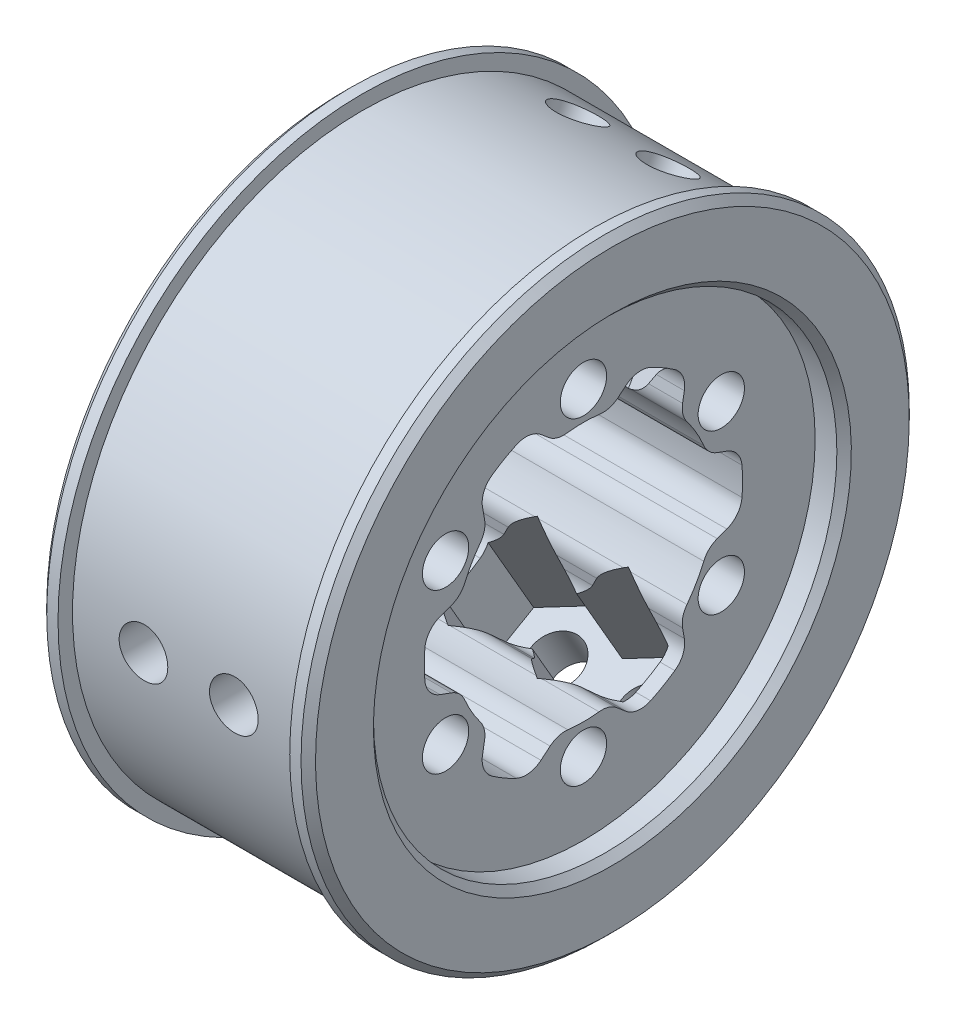
from build123d import *

# Parameters (mm, degrees)
SKETCH2_R           = 2.54
CUT_EXTRUDE3_DEPTH  = 56.595909099
SKETCH3_R           = 25.4
CUT_EXTRUDE4_DEPTH  = 3.175
CUT_EXTRUDE5_START  = -3.048
SKETCH4_R           = 25.4
CUT_EXTRUDE5_DEPTH  = 3.048
CHAMFER1_SIZE       = 0.79375
CUT_EXTRUDE6_START  = -5.08
CUT_EXTRUDE6_DEPTH  = 14.605
SKETCH10_R          = 2.667
CUT_EXTRUDE9_DEPTH  = 71.411931101
CIRPATTERN2_COUNT   = 3
SKETCH11_R          = 1.0922
CUT_EXTRUDE10_DEPTH = 67.761937332


with BuildPart() as part:
    # Sketch1 → Revolve1 (revolve)
    with BuildSketch(Plane.XY):
        Polygon((0, 0), (0, 31.75), (12.7, 31.75), (12.7, 33.3375), (14.732, 33.3375), (14.732, 0), align=None)
    revolve1 = revolve(axis=Axis((14.732, 0, 0), (-1, 0, 0)))

    # Mirror3: Revolve1 across plane
    add(revolve1.mirror(Plane.ZY))

    # Sketch2 → Cut-Extrude3 (cut, through all)
    with BuildSketch(Plane(origin=(14.732, 0, 0), x_dir=(0, 0, -1), z_dir=(1, 0, 0))):
        with Locations(Location((0, 17.4498, 0), (0, 0, 90))):
            Circle(SKETCH2_R)
        with Locations(Location((15.111970091, 8.7249, 0), (0, 0, 90))):
            Circle(SKETCH2_R)
        with Locations(Location((15.111970091, -8.7249, 0), (0, 0, 90))):
            Circle(SKETCH2_R)
        with Locations(Location((0, -17.4498, 0), (0, 0, 90))):
            Circle(SKETCH2_R)
        with Locations(Location((-15.111970091, -8.7249, 0), (0, 0, 90))):
            Circle(SKETCH2_R)
        with Locations(Location((-15.111970091, 8.7249, 0), (0, 0, 90))):
            Circle(SKETCH2_R)
        with BuildLine():
            Line((14.665568358, 4.08236111), (15.720738661, 3.698310528))
            ThreePointArc((15.720738661, 3.698310528), (16.866499311, 2.858560348), (17.382162096, 1.534913975))
            ThreePointArc((17.382162096, 1.534913975), (17.4498, 0), (17.382162096, -1.534913975))
            ThreePointArc((17.382162096, -1.534913975), (16.866499311, -2.858560348), (15.720738661, -3.698310528))
            Line((15.720738661, -3.698310528), (14.665568358, -4.08236111))
            ThreePointArc((14.665568358, -4.08236111), (13.779603056, -4.632705397), (13.189499594, -5.492700312))
            ThreePointArc((13.189499594, -5.492700312), (12.373337957, -7.14375), (11.351567802, -8.676091556))
            ThreePointArc((11.351567802, -8.676091556), (10.90184209, -9.617133602), (10.868212608, -10.659574204))
            Line((10.868212608, -10.659574204), (11.063200199, -11.765403783))
            ThreePointArc((11.063200199, -11.765403783), (10.908835536, -13.177536702), (10.020355543, -14.28593696))
            ThreePointArc((10.020355543, -14.28593696), (8.7249, -15.111970091), (7.361806553, -15.820850935))
            ThreePointArc((7.361806553, -15.820850935), (5.957663775, -16.03609705), (4.657538462, -15.46371431))
            Line((4.657538462, -15.46371431), (3.648569587, -14.617088899))
            ThreePointArc((3.648569587, -14.617088899), (2.738575306, -14.127821336), (1.709006412, -14.041448709))
            ThreePointArc((1.709006412, -14.041448709), (0, -14.145069274), (-1.709006412, -14.041448709))
            ThreePointArc((-1.709006412, -14.041448709), (-2.738575306, -14.127821336), (-3.648569587, -14.617088899))
            Line((-3.648569587, -14.617088899), (-4.657538462, -15.46371431))
            ThreePointArc((-4.657538462, -15.46371431), (-5.957663775, -16.03609705), (-7.361806553, -15.820850935))
            ThreePointArc((-7.361806553, -15.820850935), (-8.7249, -15.111970091), (-10.020355543, -14.28593696))
            ThreePointArc((-10.020355543, -14.28593696), (-10.908835536, -13.177536702), (-11.063200199, -11.765403783))
            Line((-11.063200199, -11.765403783), (-10.834485523, -10.468298399))
            ThreePointArc((-10.834485523, -10.468298399), (-10.865764524, -9.435586453), (-11.305748082, -8.500767323))
            ThreePointArc((-11.305748082, -8.500767323), (-12.249989329, -7.072534637), (-13.014754494, -5.540681386))
            ThreePointArc((-13.014754494, -5.540681386), (-13.60433983, -4.692234882), (-14.483055109, -4.1487905))
            Line((-14.483055109, -4.1487905), (-15.720738661, -3.698310528))
            ThreePointArc((-15.720738661, -3.698310528), (-16.866499311, -2.858560348), (-17.382162096, -1.534913975))
            ThreePointArc((-17.382162096, -1.534913975), (-17.4498, 0), (-17.382162096, 1.534913975))
            ThreePointArc((-17.382162096, 1.534913975), (-16.866499311, 2.858560348), (-15.720738661, 3.698310528))
            Line((-15.720738661, 3.698310528), (-14.483055109, 4.1487905))
            ThreePointArc((-14.483055109, 4.1487905), (-13.60433983, 4.692234882), (-13.014754494, 5.540681386))
            ThreePointArc((-13.014754494, 5.540681386), (-12.249989329, 7.072534637), (-11.305748082, 8.500767323))
            ThreePointArc((-11.305748082, 8.500767323), (-10.865764524, 9.435586453), (-10.834485523, 10.468298399))
            Line((-10.834485523, 10.468298399), (-11.063200199, 11.765403783))
            ThreePointArc((-11.063200199, 11.765403783), (-10.908835536, 13.177536702), (-10.020355543, 14.28593696))
            ThreePointArc((-10.020355543, 14.28593696), (-8.7249, 15.111970091), (-7.361806553, 15.820850935))
            ThreePointArc((-7.361806553, 15.820850935), (-5.957663775, 16.03609705), (-4.657538462, 15.46371431))
            Line((-4.657538462, 15.46371431), (-3.79735575, 14.741935314))
            ThreePointArc((-3.79735575, 14.741935314), (-2.877760966, 14.249838999), (-1.837931792, 14.168791867))
            ThreePointArc((-1.837931792, 14.168791867), (0, 14.2875), (1.837931792, 14.168791867))
            ThreePointArc((1.837931792, 14.168791867), (2.877760966, 14.249838999), (3.79735575, 14.741935314))
            Line((3.79735575, 14.741935314), (4.657538462, 15.46371431))
            ThreePointArc((4.657538462, 15.46371431), (5.957663775, 16.03609705), (7.361806553, 15.820850935))
            ThreePointArc((7.361806553, 15.820850935), (8.7249, 15.111970091), (10.020355543, 14.28593696))
            ThreePointArc((10.020355543, 14.28593696), (10.908835536, 13.177536702), (11.063200199, 11.765403783))
            Line((11.063200199, 11.765403783), (10.868212608, 10.659574204))
            ThreePointArc((10.868212608, 10.659574204), (10.90184209, 9.617133602), (11.351567802, 8.676091556))
            ThreePointArc((11.351567802, 8.676091556), (12.373337957, 7.14375), (13.189499594, 5.492700312))
            ThreePointArc((13.189499594, 5.492700312), (13.779603056, 4.632705397), (14.665568358, 4.08236111))
        make_face()
    extrude(amount=-CUT_EXTRUDE3_DEPTH, mode=Mode.SUBTRACT)

    # Sketch3 → Cut-Extrude4 (cut)
    with BuildSketch(Plane(origin=(14.732, 0, 0), x_dir=(0, 0, -1), z_dir=(1, 0, 0))):
        with Locations(Location((0, 0, 0), (0, 0, 90))):
            Circle(SKETCH3_R)
    extrude(amount=-CUT_EXTRUDE4_DEPTH, mode=Mode.SUBTRACT)

    # Sketch4 → Cut-Extrude5 (cut)
    with BuildSketch(Plane.ZY.offset(14.732).offset(CUT_EXTRUDE5_START)):
        with Locations(Location((0, 0, 0), (0, 0, 90))):
            Circle(SKETCH4_R)
    extrude(amount=CUT_EXTRUDE5_DEPTH, mode=Mode.SUBTRACT)

    # Chamfer1
    chamfer1_edges = [part.edges().sort_by_distance(p)[0] for p in [
        (-14.732, -33.3375, 0),
        (14.732, -25.4, 0),
        (-14.732, -25.4, 0),
        (14.732, -33.3375, 0),
    ]]
    chamfer(chamfer1_edges, length=CHAMFER1_SIZE)

    # Sketch7 → Cut-Extrude6 (cut)
    with BuildSketch(Plane.XY.offset(17.382162096).offset(CUT_EXTRUDE6_START)):
        Polygon((-4.92125, 5.60924654), (-9.779, 2.80462327), (-9.779, -2.80462327), (-4.92125, -5.60924654), (-0.0635, -2.80462327), (4.98475, -5.719231767), (9.93775, -2.859615883), (9.93775, 2.859615883), (4.98475, 5.719231767), (-0.0635, 2.80462327), align=None)
    cut_extrude6 = extrude(amount=CUT_EXTRUDE6_DEPTH, mode=Mode.SUBTRACT)

    # Sketch10 → Cut-Extrude9 (cut, through all)
    with BuildSketch(Plane(origin=(0, 0, 26.907162096), x_dir=(-1, 0, 0), z_dir=(0, 0, -1))):
        with Locations((-4.98475, 0)):
            Circle(SKETCH10_R)
        with Locations((4.92125, 0)):
            Circle(SKETCH10_R)
    cut_extrude9 = extrude(amount=-CUT_EXTRUDE9_DEPTH, mode=Mode.SUBTRACT)

    # CirPattern2: Cut-Extrude6, Cut-Extrude9 ×3 about axis
    cirpattern2_axis = Axis((0, 0, 0), (1, 0, 0))
    add([cut_extrude6.rotate(cirpattern2_axis, i * 360 / CIRPATTERN2_COUNT) for i in range(1, CIRPATTERN2_COUNT)], mode=Mode.SUBTRACT)
    add([cut_extrude9.rotate(cirpattern2_axis, i * 360 / CIRPATTERN2_COUNT) for i in range(1, CIRPATTERN2_COUNT)], mode=Mode.SUBTRACT)

    # Sketch11 → Cut-Extrude10 (cut, through all)
    with BuildSketch(Plane(origin=(0, -21.287249995, -2.106274352), x_dir=(1, 0, 0), z_dir=(0, 0.8660254037844386, -0.5000000000000002))):
        with Locations(Location((-7.9375, -6.117712094, 0), (0, 0, 270))):
            Circle(SKETCH11_R)
        with Locations(Location((-7.9375, -18.817712094, 0), (0, 0, 270))):
            Circle(SKETCH11_R)
        with Locations(Location((7.9375, -18.817712094, 0), (0, 0, 270))):
            Circle(SKETCH11_R)
        with Locations(Location((7.9375, -6.117712094, 0), (0, 0, 270))):
            Circle(SKETCH11_R)
    extrude(amount=-CUT_EXTRUDE10_DEPTH, mode=Mode.SUBTRACT)


solid = part.part
